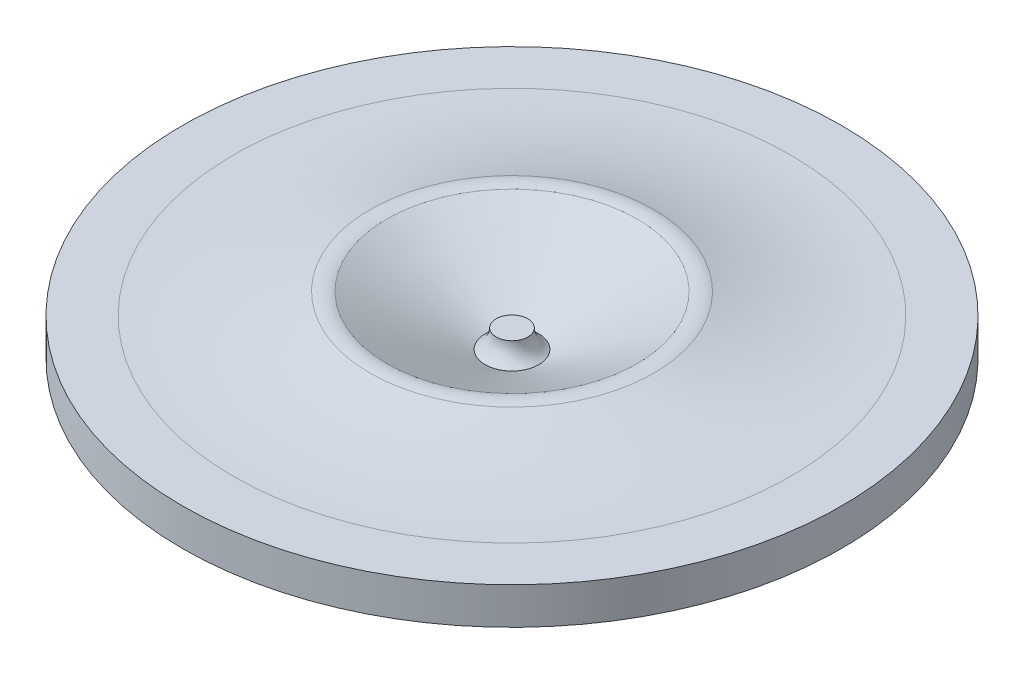
from build123d import *


with BuildPart() as part:
    # Sketch1 → Revolve1 (revolve)
    with BuildSketch(Plane(origin=(0, 0, 1.383780883), x_dir=(0, -1, 0), z_dir=(0, 0, 1)), mode=Mode.PRIVATE) as revolve1_sk:
        with BuildLine():
            Line((-6.482641531, -22.236737445), (-16.482641531, -22.236737445))
            Line((-16.482641531, -22.236737445), (-16.482641531, -16.236737445))
            ThreePointArc((-16.482641531, -16.236737445), (-12.404820423, -15.119424058), (-9.466050343, -12.079581198))
            Line((-9.466050343, -12.079581198), (-28.482641531, 25.263262555))
            ThreePointArc((-28.482641531, 25.263262555), (-28.968073531, 28.408526495), (-28.482641531, 31.553790435))
            ThreePointArc((-28.482641531, 31.553790435), (-22.494411783, 57.164168196), (-20.482641531, 83.388262555))
            Line((-20.482641531, 83.388262555), (-20.482641531, 102.763262555))
            Line((-20.482641531, 102.763262555), (-6.482641531, 102.763262555))
            Line((-6.482641531, 102.763262555), (-6.482641531, -22.236737445))
        make_face()
    revolve(revolve1_sk.sketch.rotate(Axis((-22.236737445, 6.482641531, 1.383780883), (0, 1, 0)), 90), axis=Axis((-22.236737445, 6.482641531, 1.383780883), (0, 1, 0)))


solid = part.part
